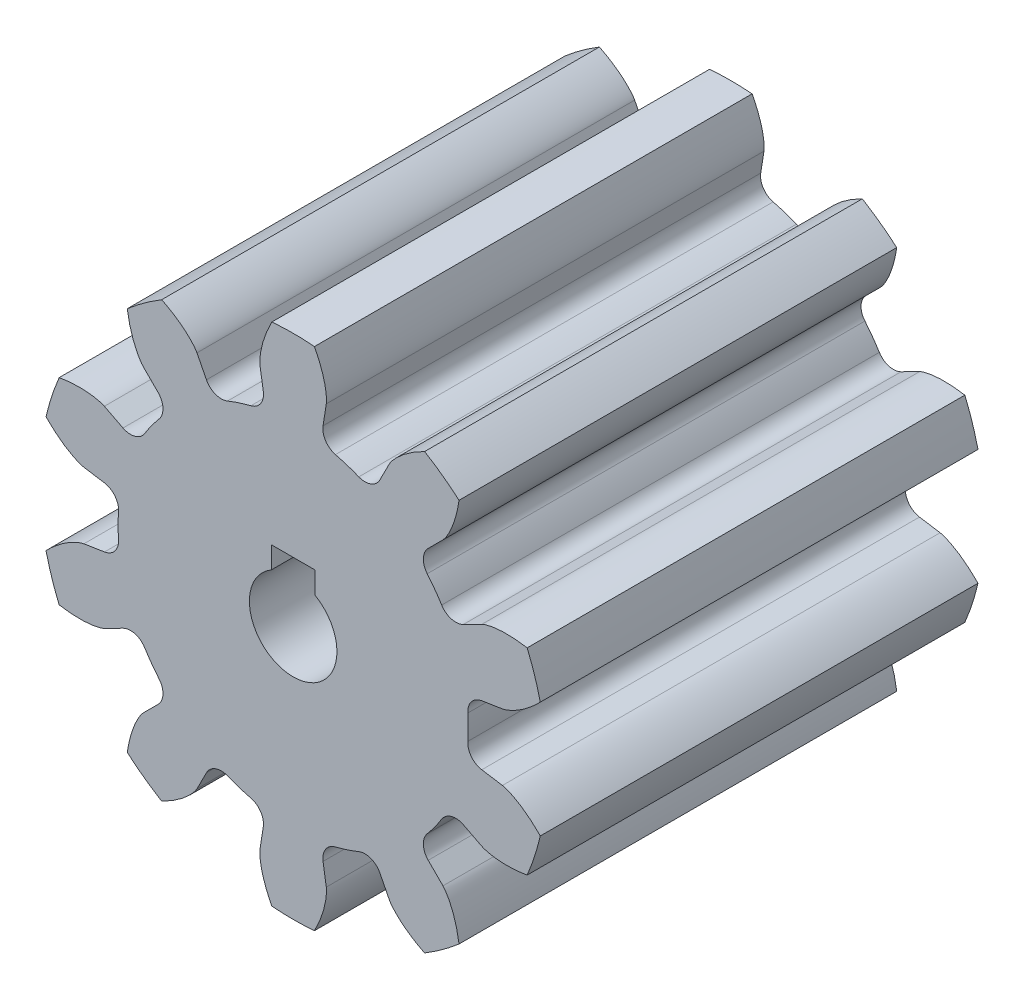
from build123d import *

# Parameters (mm, degrees)
ROOT_DIA_SKETCH_R                       = 8
ROOT_CIRCLE_EXTRUDE_DEPTH               = 10
TOOTH_PROFILE_EXTRUDE_REACH             = 17.1
TOOTH_PROFILE_EXTRUDE_DIRECTION_2_REACH = 17.1
ROOT_RADIUS_FILLET_R                    = 0.76
CIRPATTERN1_COUNT                       = 10
ROOT_RADIUS_FILLET_OF_CIRPATTERN1_R     = 0.76
CUT_EXTRUDE1_DEPTH                      = 26.731525206
CUT_EXTRUDE1_DEPTH_BACK                 = 26.731525206
SKETCH1_R                               = 2
CUT_EXTRUDE2_DEPTH                      = 26.731525206
CUT_EXTRUDE2_DEPTH_BACK                 = 26.731525206
SKETCH2_W                               = 2
SKETCH2_H                               = 1


with BuildPart() as part:
    # Root Dia Sketch → Root Circle Extrude (new, symmetric)
    with BuildSketch(Plane.XY):
        Circle(ROOT_DIA_SKETCH_R)
    extrude(amount=ROOT_CIRCLE_EXTRUDE_DEPTH, both=True)

    # Tooth Profile Extrude: up to this face of the body (flat: up to its plane)
    tooth_profile_extrude_end = Plane(part.part.faces().sort_by_distance((0, 0, 10))[0])
    # Tooth Profile Sketch → Tooth Profile Extrude (add, up to the picked face)
    with BuildSketch(Plane.XY, mode=Mode.PRIVATE) as tooth_profile_extrude_sk1:
        with BuildLine():
            Line((1.25147572, 7.901506725), (1.514516582, 9.562281364))
            add(Edge.make_bspline(
                [(1.514516582, 9.562281364), (1.515207357, 9.566642743), (1.5169202, 9.578909679), (1.519270402, 9.602229605), (1.521838667, 9.640421767), (1.52324702, 9.689257615), (1.522922728, 9.752515252), (1.51978173, 9.827151142), (1.513438988, 9.909222088), (1.503422216, 9.998486525), (1.490676479, 10.087459012), (1.475406016, 10.176081253), (1.457891769, 10.264207757), (1.433965354, 10.370713749), (1.40151004, 10.498047972), (1.358122257, 10.646174432), (1.302500858, 10.813216091), (1.239019296, 10.982215249), (1.170986986, 11.147415982), (1.095925506, 11.31285859), (1.037376765, 11.433605757), (0.994867051, 11.516117235), (0.972976728, 11.557692969), (0.972188449, 11.559188969)],
                knots=[0, 0, 0, 0, 0, 0.005376749, 0.015083688, 0.02853182, 0.046610139, 0.064854849, 0.092110525, 0.119476176, 0.146842496, 0.174208854, 0.201574956, 0.228941013, 0.256307345, 0.307035032, 0.361767352, 0.416499661, 0.471231936, 0.525964282, 0.580696615, 0.635428982, 0.63747275, 0.63747275, 0.63747275, 0.63747275, 0.63747275], degree=4))
            ThreePointArc((0.972188449, 11.559188969), (0, 11.6), (-0.972188449, 11.559188969))
            add(Edge.make_bspline(
                [(-1.514516582, 9.562281364), (-1.515207357, 9.566642743), (-1.5169202, 9.578909679), (-1.519270402, 9.602229605), (-1.521838667, 9.640421767), (-1.52324702, 9.689257615), (-1.522922728, 9.752515252), (-1.51978173, 9.827151142), (-1.513438988, 9.909222088), (-1.503422216, 9.998486525), (-1.490676479, 10.087459012), (-1.475406016, 10.176081253), (-1.457891769, 10.264207757), (-1.433965354, 10.370713749), (-1.40151004, 10.498047972), (-1.358122257, 10.646174432), (-1.302500858, 10.813216091), (-1.239019296, 10.982215249), (-1.170986986, 11.147415982), (-1.095925506, 11.31285859), (-1.037376765, 11.433605757), (-0.994867051, 11.516117235), (-0.972976728, 11.557692969), (-0.972188449, 11.559188969)],
                knots=[0, 0, 0, 0, 0, 0.005376749, 0.015083688, 0.02853182, 0.046610139, 0.064854849, 0.092110525, 0.119476176, 0.146842496, 0.174208854, 0.201574956, 0.228941013, 0.256307345, 0.307035032, 0.361767352, 0.416499661, 0.471231936, 0.525964282, 0.580696615, 0.635428982, 0.63747275, 0.63747275, 0.63747275, 0.63747275, 0.63747275], degree=4))
            Line((-1.514516582, 9.562281364), (-1.25147572, 7.901506725))
            ThreePointArc((-1.25147572, 7.901506725), (0, 8), (1.25147572, 7.901506725))
        make_face()
    tooth_profile_extrude_tool1 = split(extrude(tooth_profile_extrude_sk1.sketch, amount=TOOTH_PROFILE_EXTRUDE_REACH, mode=Mode.PRIVATE), bisect_by=tooth_profile_extrude_end, keep=Keep.BOTH, mode=Mode.PRIVATE)
    tooth_profile_extrude = tooth_profile_extrude_tool1.solids().sort_by(Axis((0, 9.729435, 0), (0, 0, 1)))[0]
    add(tooth_profile_extrude)

    # Tooth Profile Extrude direction 2: up to this face of the body (flat: up to its plane)
    tooth_profile_extrude_direction_2_end = Plane(part.part.faces().sort_by_distance((0, 0, -10))[0])
    # Tooth Profile Sketch → Tooth Profile Extrude direction 2 (add, up to the picked face)
    with BuildSketch(Plane.XY, mode=Mode.PRIVATE) as tooth_profile_extrude_direction_2_sk1:
        with BuildLine():
            Line((1.25147572, 7.901506725), (1.514516582, 9.562281364))
            add(Edge.make_bspline(
                [(1.514516582, 9.562281364), (1.515207357, 9.566642743), (1.5169202, 9.578909679), (1.519270402, 9.602229605), (1.521838667, 9.640421767), (1.52324702, 9.689257615), (1.522922728, 9.752515252), (1.51978173, 9.827151142), (1.513438988, 9.909222088), (1.503422216, 9.998486525), (1.490676479, 10.087459012), (1.475406016, 10.176081253), (1.457891769, 10.264207757), (1.433965354, 10.370713749), (1.40151004, 10.498047972), (1.358122257, 10.646174432), (1.302500858, 10.813216091), (1.239019296, 10.982215249), (1.170986986, 11.147415982), (1.095925506, 11.31285859), (1.037376765, 11.433605757), (0.994867051, 11.516117235), (0.972976728, 11.557692969), (0.972188449, 11.559188969)],
                knots=[0, 0, 0, 0, 0, 0.005376749, 0.015083688, 0.02853182, 0.046610139, 0.064854849, 0.092110525, 0.119476176, 0.146842496, 0.174208854, 0.201574956, 0.228941013, 0.256307345, 0.307035032, 0.361767352, 0.416499661, 0.471231936, 0.525964282, 0.580696615, 0.635428982, 0.63747275, 0.63747275, 0.63747275, 0.63747275, 0.63747275], degree=4))
            ThreePointArc((0.972188449, 11.559188969), (0, 11.6), (-0.972188449, 11.559188969))
            add(Edge.make_bspline(
                [(-1.514516582, 9.562281364), (-1.515207357, 9.566642743), (-1.5169202, 9.578909679), (-1.519270402, 9.602229605), (-1.521838667, 9.640421767), (-1.52324702, 9.689257615), (-1.522922728, 9.752515252), (-1.51978173, 9.827151142), (-1.513438988, 9.909222088), (-1.503422216, 9.998486525), (-1.490676479, 10.087459012), (-1.475406016, 10.176081253), (-1.457891769, 10.264207757), (-1.433965354, 10.370713749), (-1.40151004, 10.498047972), (-1.358122257, 10.646174432), (-1.302500858, 10.813216091), (-1.239019296, 10.982215249), (-1.170986986, 11.147415982), (-1.095925506, 11.31285859), (-1.037376765, 11.433605757), (-0.994867051, 11.516117235), (-0.972976728, 11.557692969), (-0.972188449, 11.559188969)],
                knots=[0, 0, 0, 0, 0, 0.005376749, 0.015083688, 0.02853182, 0.046610139, 0.064854849, 0.092110525, 0.119476176, 0.146842496, 0.174208854, 0.201574956, 0.228941013, 0.256307345, 0.307035032, 0.361767352, 0.416499661, 0.471231936, 0.525964282, 0.580696615, 0.635428982, 0.63747275, 0.63747275, 0.63747275, 0.63747275, 0.63747275], degree=4))
            Line((-1.514516582, 9.562281364), (-1.25147572, 7.901506725))
            ThreePointArc((-1.25147572, 7.901506725), (0, 8), (1.25147572, 7.901506725))
        make_face()
    tooth_profile_extrude_direction_2_tool1 = split(extrude(tooth_profile_extrude_direction_2_sk1.sketch, amount=-TOOTH_PROFILE_EXTRUDE_DIRECTION_2_REACH, mode=Mode.PRIVATE), bisect_by=tooth_profile_extrude_direction_2_end, keep=Keep.BOTH, mode=Mode.PRIVATE)
    tooth_profile_extrude_direction_2 = tooth_profile_extrude_direction_2_tool1.solids().sort_by(Axis((0, 9.729435, 0), (0, 0, -1)))[0]
    add(tooth_profile_extrude_direction_2)

    # Root Radius Fillet
    root_radius_fillet_edges = [part.edges().sort_by_distance(p)[0] for p in [
        (-1.25147572, 7.901506725, 0),
        (1.25147572, 7.901506725, 0),
    ]]
    fillet(root_radius_fillet_edges, radius=ROOT_RADIUS_FILLET_R)

    # CirPattern1: Tooth Profile Extrude, Tooth Profile Extrude direction 2 ×10 about axis
    cirpattern1_axis = Axis((0, 0, 10), (0, 0, -1))
    add([tooth_profile_extrude.rotate(cirpattern1_axis, i * 360 / CIRPATTERN1_COUNT) for i in range(1, CIRPATTERN1_COUNT)])
    add([tooth_profile_extrude_direction_2.rotate(cirpattern1_axis, i * 360 / CIRPATTERN1_COUNT) for i in range(1, CIRPATTERN1_COUNT)])

    # Root Radius Fillet of CirPattern1
    root_radius_fillet_of_cirpattern1_edges = [part.edges().sort_by_distance(p)[0] for p in [
        (3.631923998, 7.128052194, 0),
        (5.656854249, 5.656854249, 0),
        (7.128052194, 3.631923998, 0),
        (7.901506725, 1.25147572, 0),
        (7.901506725, -1.25147572, 0),
        (7.128052194, -3.631923998, 0),
        (5.656854249, -5.656854249, 0),
        (3.631923998, -7.128052194, 0),
        (1.25147572, -7.901506725, 0),
        (-1.25147572, -7.901506725, 0),
        (-3.631923998, -7.128052194, 0),
        (-5.656854249, -5.656854249, 0),
        (-7.128052194, -3.631923998, 0),
        (-7.901506725, -1.25147572, 0),
        (-7.901506725, 1.25147572, 0),
        (-7.128052194, 3.631923998, 0),
        (-5.656854249, 5.656854249, 0),
        (-3.631923998, 7.128052194, 0),
    ]]
    fillet(root_radius_fillet_of_cirpattern1_edges, radius=ROOT_RADIUS_FILLET_OF_CIRPATTERN1_R)

    # Sketch1 → Cut-Extrude1 (cut, two sides: drawn at the far end of the back side and taken through both)
    with BuildSketch(Plane.XY.offset(10).offset(-CUT_EXTRUDE1_DEPTH_BACK)):
        Circle(SKETCH1_R)
    extrude(amount=CUT_EXTRUDE1_DEPTH + CUT_EXTRUDE1_DEPTH_BACK, mode=Mode.SUBTRACT)

    # Sketch2 → Cut-Extrude2 (cut, two sides: drawn at the far end of the back side and taken through both)
    with BuildSketch(Plane.XY.offset(10).offset(-CUT_EXTRUDE2_DEPTH_BACK)):
        with Locations((0, 2.232050808)):
            Rectangle(SKETCH2_W, SKETCH2_H)
    extrude(amount=CUT_EXTRUDE2_DEPTH + CUT_EXTRUDE2_DEPTH_BACK, mode=Mode.SUBTRACT)


solid = part.part
